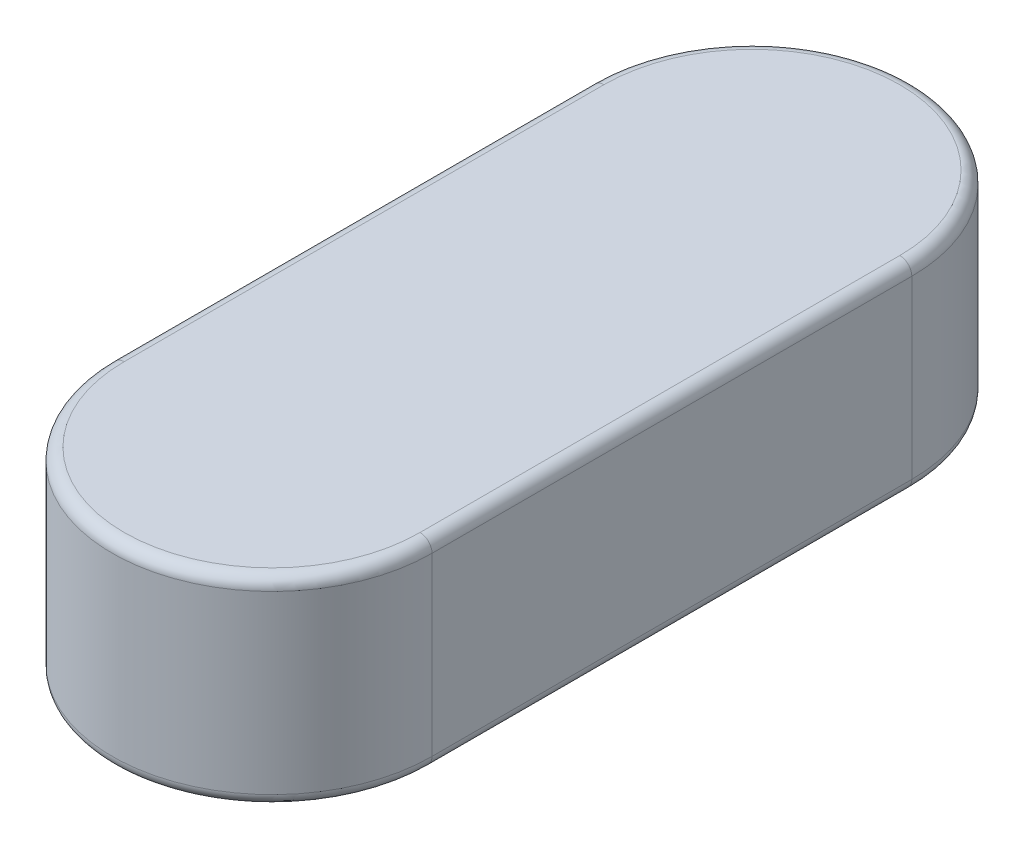
from build123d import *

# Parameters (mm, degrees)
EXTRUDE_1_DEPTH = 10
FILLET_1_R      = 0.6


with BuildPart() as part:
    # Эскиз1 → Бобышка-Вытянуть1 (new body)
    with BuildSketch(Plane(origin=(0, 0, 0), x_dir=(1, 0, 0), z_dir=(0, 1, 0))):
        with BuildLine():
            Line((-8, 0), (-8, 24))
            ThreePointArc((-8, 24), (0, 32), (8, 24))
            Line((8, 24), (8, 0))
            ThreePointArc((8, 0), (0, -8), (-8, 0))
        make_face()
    extrude(amount=EXTRUDE_1_DEPTH)

    # Скругление1
    fillet_1_edges = [part.edges().sort_by_distance(p)[0] for p in [
        (0, 10, -32),
        (-8, 10, -12),
        (0, 10, 8),
        (-8, 0, -12),
        (0, 0, -32),
        (8, 0, -12),
        (0, 0, 8),
        (8, 10, -12),
    ]]
    fillet(fillet_1_edges, radius=FILLET_1_R)


solid = part.part
